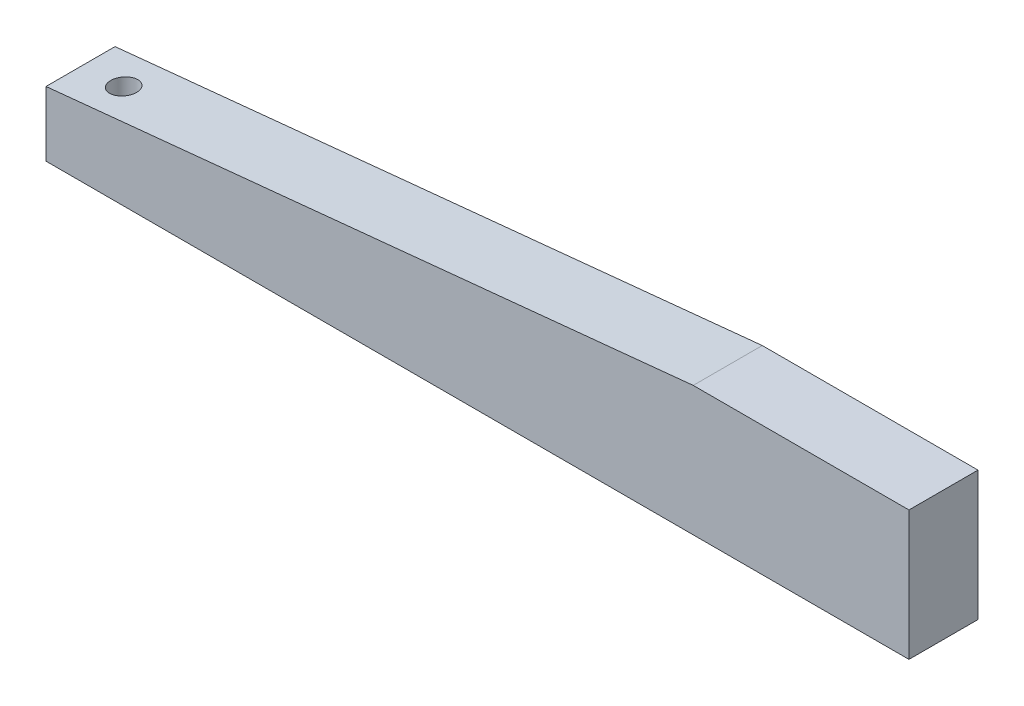
from build123d import *

# Parameters (mm, degrees)
BOSS_EXTRU_1_DEPTH           = 16
ENL_V_MAT_EXTRU_1_DEPTH      = 203.869416128
ENL_V_MAT_EXTRU_1_DEPTH_BACK = 203.869416128
ESQUISSE2_R                  = 3


with BuildPart() as part:
    # Esquisse1 → Boss.-Extru.1 (new body)
    with BuildSketch(Plane.XY):
        Polygon((0, 0), (200, 0), (200, 30), (150, 30), (0, 15), align=None)
    extrude(amount=BOSS_EXTRU_1_DEPTH)

    # Esquisse2 → Enlèv. mat.-Extru.1 (cut, two sides: drawn at the far end of the back side and taken through both)
    with BuildSketch(Plane.XZ.offset(-ENL_V_MAT_EXTRU_1_DEPTH_BACK)):
        with Locations(Location((10, 8, 0), (0, 0, 180))):
            Circle(ESQUISSE2_R)
    extrude(amount=ENL_V_MAT_EXTRU_1_DEPTH + ENL_V_MAT_EXTRU_1_DEPTH_BACK, mode=Mode.SUBTRACT)


solid = part.part
